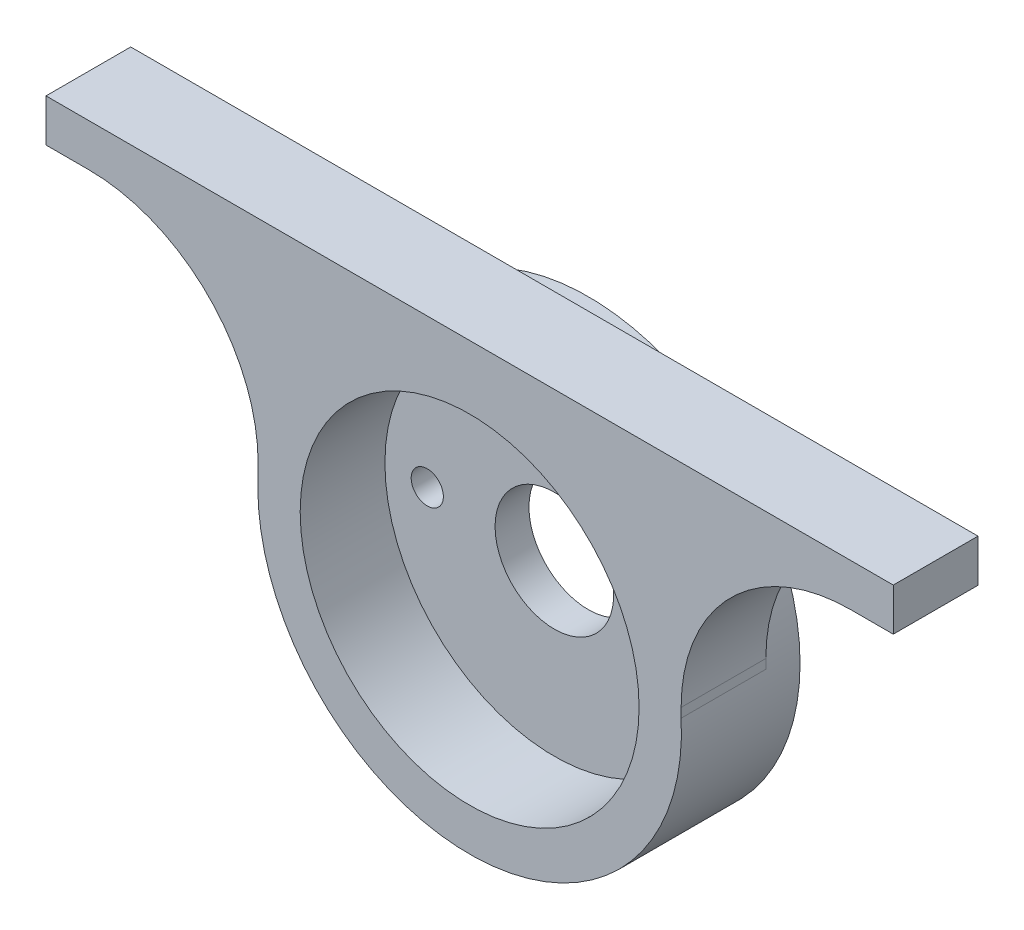
from build123d import *

# Parameters (mm, degrees)
SKETCH1_R           = 10
BOSS_EXTRUDE1_DEPTH = 5
BOSS_EXTRUDE3_START = 2
SKETCH3_R           = 12.5
SKETCH3_R_2         = 3.5
SKETCH3_R_3         = 0.95
BOSS_EXTRUDE3_DEPTH = 2


with BuildPart() as part:
    # Sketch1 → Boss-Extrude1 (new body)
    with BuildSketch(Plane.XY):
        with BuildLine():
            Line((-25, 13.756613757), (-25, 11.243386243))
            Line((-25, 11.243386243), (-22.480898871, 11.243386243))
            ThreePointArc((-22.480898871, 11.243386243), (-15.409831059, 8.314454055), (-12.480898871, 1.243386243))
            Line((-12.480898871, 1.243386243), (-12.480898871, 0.690770135))
            ThreePointArc((-12.480898871, 0.690770135), (0, -12.5), (12.480898871, 0.690770135))
            Line((12.480898871, 0.690770135), (12.480898871, 1.243386243))
            ThreePointArc((12.480898871, 1.243386243), (15.409831059, 8.314454055), (22.480898871, 11.243386243))
            Line((22.480898871, 11.243386243), (25, 11.243386243))
            Line((25, 11.243386243), (25, 13.756613757))
            Line((25, 13.756613757), (-25, 13.756613757))
        make_face()
        Circle(SKETCH1_R, mode=Mode.SUBTRACT)
    extrude(amount=BOSS_EXTRUDE1_DEPTH)

    # Sketch3 → Boss-Extrude3 (add)
    with BuildSketch(Plane(origin=(0, 0, 0), x_dir=(-1, 0, 0), z_dir=(0, 0, -1)).offset(BOSS_EXTRUDE3_START)):
        Circle(SKETCH3_R)
        Circle(SKETCH3_R_2, mode=Mode.SUBTRACT)
        with Locations((7.5, 0)):
            Circle(SKETCH3_R_3, mode=Mode.SUBTRACT)
        with Locations((-7.5, 0)):
            Circle(SKETCH3_R_3, mode=Mode.SUBTRACT)
    extrude(amount=-BOSS_EXTRUDE3_DEPTH)


solid = part.part
